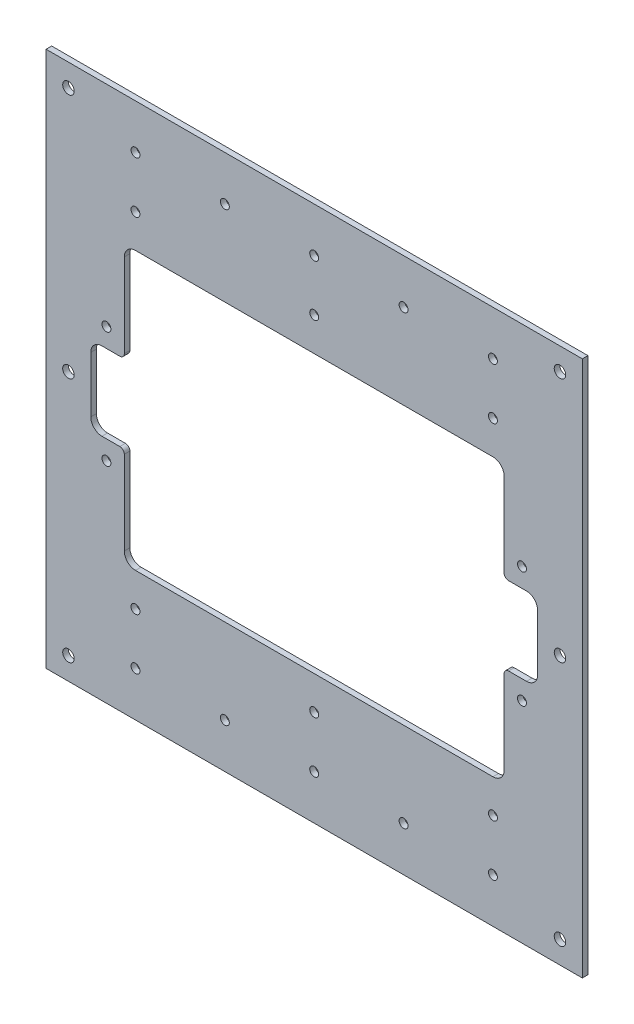
from build123d import *

# Parameters (mm, degrees)
SKETCH1_W           = 304.8
SKETCH1_H           = 304.8
SKETCH1_R           = 2.54
SKETCH1_R_2         = 3.2639
BOSS_EXTRUDE1_DEPTH = 3.175


with BuildPart() as part:
    # Sketch1 → Boss-Extrude1 (new body)
    with BuildSketch(Plane.XY):
        Rectangle(SKETCH1_W, SKETCH1_H)
        with Locations((-50.8, 127)):
            Circle(SKETCH1_R, mode=Mode.SUBTRACT)
        with Locations((0, 127)):
            Circle(SKETCH1_R, mode=Mode.SUBTRACT)
        with Locations((50.8, 127)):
            Circle(SKETCH1_R, mode=Mode.SUBTRACT)
        with Locations((50.8, -127)):
            Circle(SKETCH1_R, mode=Mode.SUBTRACT)
        with Locations((0, -127)):
            Circle(SKETCH1_R, mode=Mode.SUBTRACT)
        with Locations((-50.8, -127)):
            Circle(SKETCH1_R, mode=Mode.SUBTRACT)
        with Locations((-101.6, 97.79)):
            Circle(SKETCH1_R, mode=Mode.SUBTRACT)
        with Locations((0, 97.79)):
            Circle(SKETCH1_R, mode=Mode.SUBTRACT)
        with Locations((101.6, 97.79)):
            Circle(SKETCH1_R, mode=Mode.SUBTRACT)
        with Locations((101.6, 127)):
            Circle(SKETCH1_R, mode=Mode.SUBTRACT)
        with Locations((-101.6, 127)):
            Circle(SKETCH1_R, mode=Mode.SUBTRACT)
        with Locations((-118.11, 33.02)):
            Circle(SKETCH1_R, mode=Mode.SUBTRACT)
        with Locations((-101.6, -127)):
            Circle(SKETCH1_R, mode=Mode.SUBTRACT)
        with Locations((101.6, -127)):
            Circle(SKETCH1_R, mode=Mode.SUBTRACT)
        with Locations((101.6, -97.79)):
            Circle(SKETCH1_R, mode=Mode.SUBTRACT)
        with Locations((0, -97.79)):
            Circle(SKETCH1_R, mode=Mode.SUBTRACT)
        with Locations((-101.6, -97.79)):
            Circle(SKETCH1_R, mode=Mode.SUBTRACT)
        with Locations((-118.11, -33.02)):
            Circle(SKETCH1_R, mode=Mode.SUBTRACT)
        with Locations((-139.7, 139.7)):
            Circle(SKETCH1_R_2, mode=Mode.SUBTRACT)
        with Locations((-139.7, 0)):
            Circle(SKETCH1_R_2, mode=Mode.SUBTRACT)
        with Locations((-139.7, -139.7)):
            Circle(SKETCH1_R_2, mode=Mode.SUBTRACT)
        with Locations((139.7, -139.7)):
            Circle(SKETCH1_R_2, mode=Mode.SUBTRACT)
        with Locations((139.7, 0)):
            Circle(SKETCH1_R_2, mode=Mode.SUBTRACT)
        with Locations((139.7, 139.7)):
            Circle(SKETCH1_R_2, mode=Mode.SUBTRACT)
        with Locations((118.11, -33.02)):
            Circle(SKETCH1_R, mode=Mode.SUBTRACT)
        with Locations((118.11, 33.02)):
            Circle(SKETCH1_R, mode=Mode.SUBTRACT)
        with BuildLine():
            Line((-101.6, 78.74), (101.6, 78.74))
            ThreePointArc((101.6, 78.74), (106.090128061, 76.880128061), (107.95, 72.39))
            Line((107.95, 72.39), (107.95, 24.765))
            ThreePointArc((107.95, 24.765), (108.693948776, 22.968948776), (110.49, 22.225))
            Line((110.49, 22.225), (120.65, 22.225))
            ThreePointArc((120.65, 22.225), (125.140128061, 20.365128061), (127, 15.875))
            Line((127, 15.875), (127, -15.875))
            ThreePointArc((127, -15.875), (125.140128061, -20.365128061), (120.65, -22.225))
            Line((120.65, -22.225), (110.49, -22.225))
            ThreePointArc((110.49, -22.225), (108.693948776, -22.968948776), (107.95, -24.765))
            Line((107.95, -24.765), (107.95, -72.39))
            ThreePointArc((107.95, -72.39), (106.090128061, -76.880128061), (101.6, -78.74))
            Line((101.6, -78.74), (-101.6, -78.74))
            ThreePointArc((-101.6, -78.74), (-106.090128061, -76.880128061), (-107.95, -72.39))
            Line((-107.95, -72.39), (-107.95, -24.765))
            ThreePointArc((-107.95, -24.765), (-108.693948776, -22.968948776), (-110.49, -22.225))
            Line((-110.49, -22.225), (-120.65, -22.225))
            ThreePointArc((-120.65, -22.225), (-125.140128061, -20.365128061), (-127, -15.875))
            Line((-127, -15.875), (-127, 15.875))
            ThreePointArc((-127, 15.875), (-125.140128061, 20.365128061), (-120.65, 22.225))
            Line((-120.65, 22.225), (-110.49, 22.225))
            ThreePointArc((-110.49, 22.225), (-108.693948776, 22.968948776), (-107.95, 24.765))
            Line((-107.95, 24.765), (-107.95, 72.39))
            ThreePointArc((-107.95, 72.39), (-106.090128061, 76.880128061), (-101.6, 78.74))
        make_face(mode=Mode.SUBTRACT)
    extrude(amount=BOSS_EXTRUDE1_DEPTH)


solid = part.part
